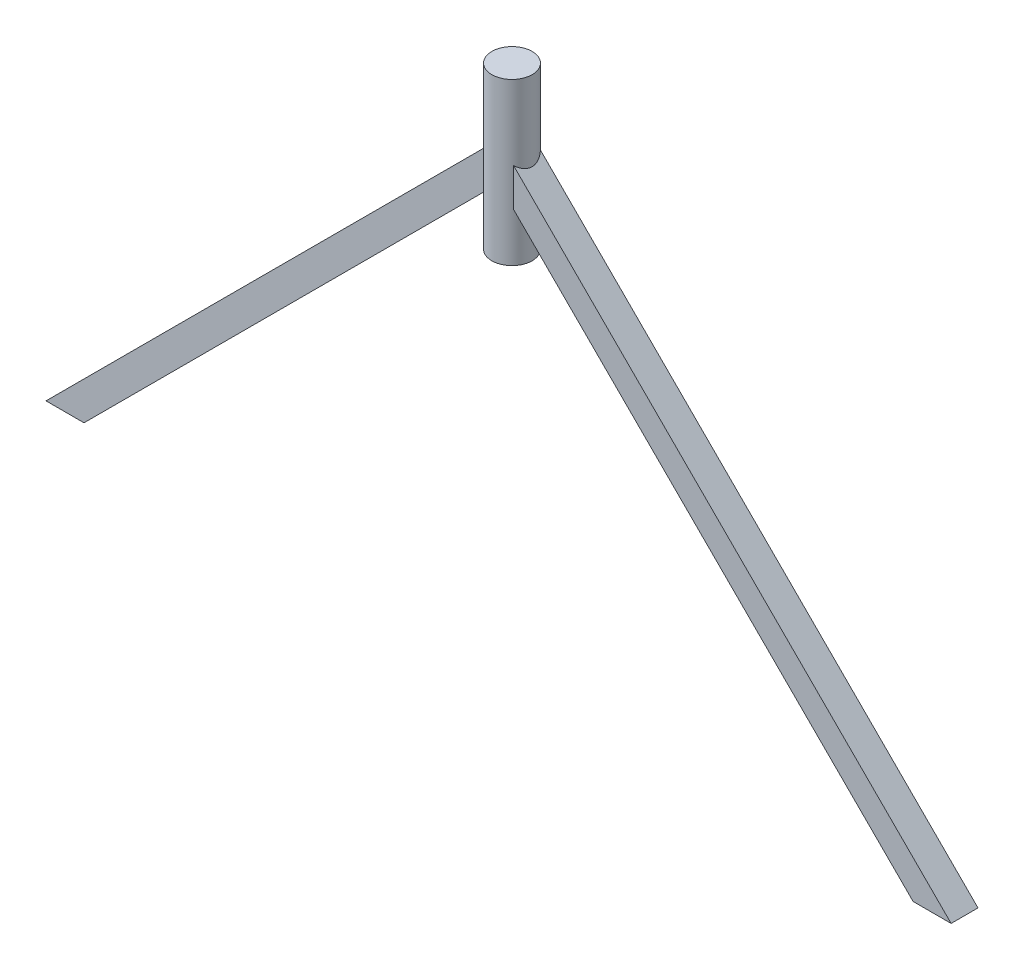
from build123d import *

# Parameters (mm, degrees)
SKETCH2_R           = 19.05
BOSS_EXTRUDE1_DEPTH = 152.4
BOSS_EXTRUDE2_DEPTH = 12.7


with BuildPart() as part:
    # Sketch2 → Boss-Extrude1 (new body)
    with BuildSketch(Plane(origin=(0, 0, 0), x_dir=(1, 0, 0), z_dir=(0, 1, 0))):
        with Locations(Location((0, 0, 0), (0, 0, 90))):
            Circle(SKETCH2_R)
    extrude(amount=BOSS_EXTRUDE1_DEPTH)

    # Sketch3 → Boss-Extrude2 (add, symmetric)
    with BuildSketch(Plane.XY):
        Polygon((-427.750314484, -331.6732), (-409.789802242, -313.712687758), (-391.82929, -331.6732), align=None)
        Polygon((-6.028675512, 90.048438972), (-409.789802242, -313.712687758), (-391.82929, -331.6732), (11.93183673, 72.08792673), align=None)
    boss_extrude2 = extrude(amount=BOSS_EXTRUDE2_DEPTH, both=True)

    # Mirror1: Boss-Extrude2 across plane
    add(boss_extrude2.mirror(Plane(origin=(0, 0, 0), x_dir=(0, 0, 1), z_dir=(1, 0, 0))))


solid = part.part
